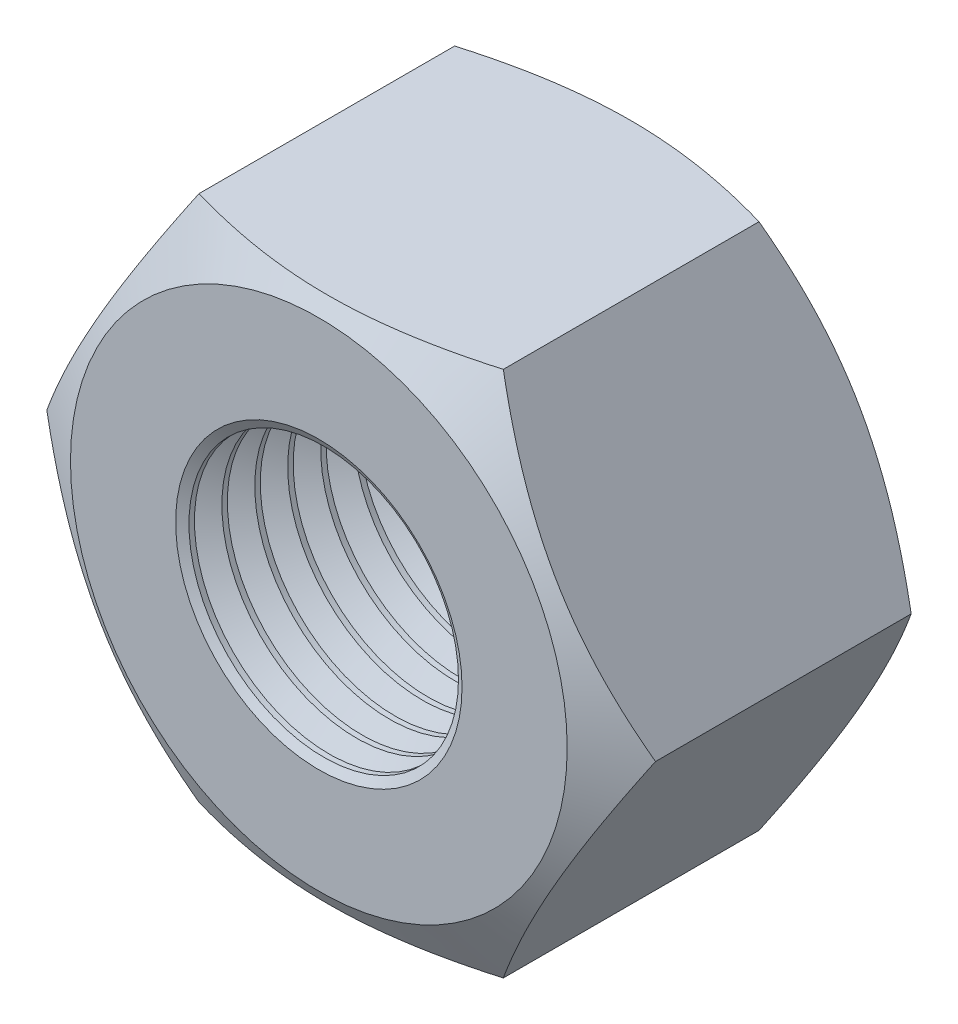
from build123d import *

# Parameters (mm, degrees)
SKETCH1_R        = 3.3235
BASENUT_DEPTH    = 7.9
LPATTERN10_COUNT = 11
LPATTERN10_PITCH = 0.8118


with BuildPart() as part:
    # Sketch1 → BaseNut (new body)
    with BuildSketch(Plane.XY):
        Polygon((3.75277675, -6.5), (7.505553499, 0), (3.75277675, 6.5), (-3.75277675, 6.5), (-7.505553499, 0), (-3.75277675, -6.5), align=None)
        Circle(SKETCH1_R, mode=Mode.SUBTRACT)
    extrude(amount=-BASENUT_DEPTH)

    # Sketch2 → Double-Chamfer (revolve, cut)
    with BuildSketch(Plane(origin=(0, 0, 0), x_dir=(1, 0, 0), z_dir=(0, 1, 0))):
        Polygon((-7.505553499, 7.9), (-6.125, 7.9), (-7.505553499, 7.102937065), align=None)
        Polygon((-7.505553499, 0.797062935), (-7.505553499, 0), (-6.125, 0), align=None)
    revolve(axis=Axis((0, 0, -3.375940562), (0, 0, 1)), mode=Mode.SUBTRACT)

    # Sketch4 → Cut-Revolve10 (revolve, cut)
    with BuildSketch(Plane(origin=(0, 0, 0), x_dir=(1, 0, 0), z_dir=(0, 1, 0))):
        Polygon((3.909366186, 7.9), (3.3235, 7.56175), (2.647, 7.56175), (2.647, 8.23825), (3.3235, 8.23825), align=None)
    cut_revolve10 = revolve(axis=Axis((0, 0, 0), (0, 0, -1)), mode=Mode.SUBTRACT)

    # LPattern10: Cut-Revolve10 ×11
    with Locations(*[(0, 0, i * LPATTERN10_PITCH) for i in range(1, LPATTERN10_COUNT)]):
        add(cut_revolve10, mode=Mode.SUBTRACT)


solid = part.part
